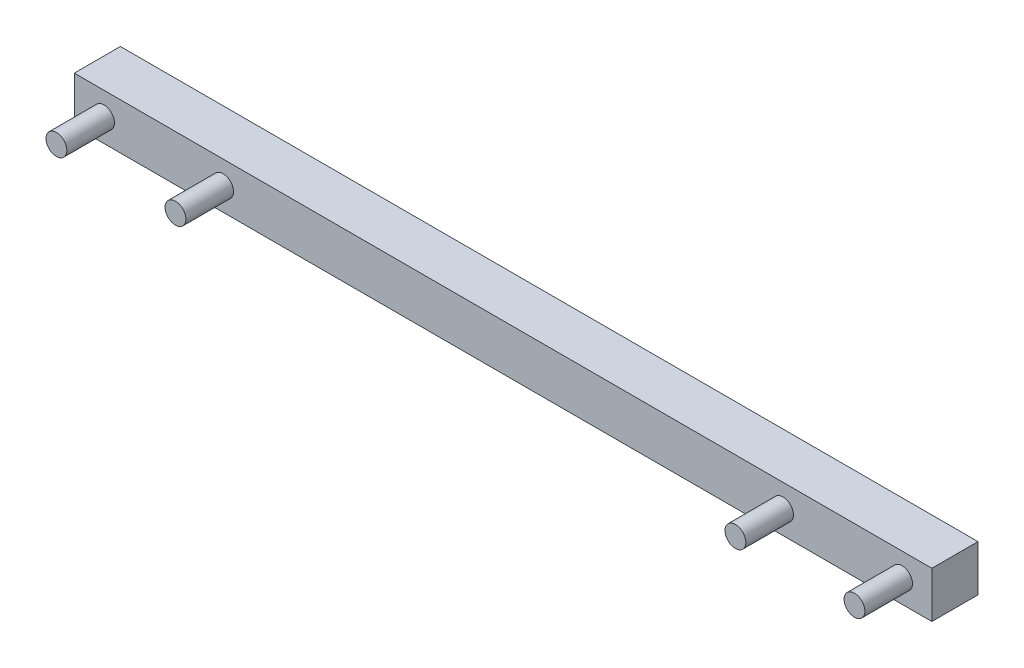
from build123d import *

# Parameters (mm, degrees)
SKETCH_2_R        = 3.5
EXTRUDE_1_DEPTH   = 16
EXTRUDE_1_2_DEPTH = 16
EXTRUDE_1_3_DEPTH = 16
EXTRUDE_1_4_DEPTH = 16
SKETCH_3_W        = 288.1
SKETCH_3_H        = 15.5
EXTRUDE_2_DEPTH   = 15.5


with BuildPart() as part:
    # 草图2 → 凸台-拉伸1 (new body)
    with BuildSketch(Plane.XY):
        with Locations((-164, 0)):
            Circle(SKETCH_2_R)
    extrude(amount=EXTRUDE_1_DEPTH)



with BuildPart() as body_2:
    # 草图2 → Extrude 1 2 (new body)
    with BuildSketch(Plane.XY):
        with Locations((24.1, 0)):
            Circle(SKETCH_2_R)
    extrude(amount=EXTRUDE_1_2_DEPTH)


with BuildPart() as body_3:
    # 草图2 → Extrude 1 3 (new body)
    with BuildSketch(Plane.XY):
        with Locations((-204, 0)):
            Circle(SKETCH_2_R)
    extrude(amount=EXTRUDE_1_3_DEPTH)


with BuildPart() as body_4:
    # 草图2 → Extrude 1 4 (new body)
    with BuildSketch(Plane.XY):
        with Locations((64.1, 0)):
            Circle(SKETCH_2_R)
    extrude(amount=EXTRUDE_1_4_DEPTH)


with BuildPart() as part_1:
    add(part.part)

    add(body_2.part)  # 凸台-拉伸2 merges body 2

    add(body_3.part)  # 凸台-拉伸2 merges body 3

    add(body_4.part)  # 凸台-拉伸2 merges body 4
    # 草图3 → 凸台-拉伸2 (add)
    with BuildSketch(Plane(origin=(0, 0, 0), x_dir=(-1, 0, 0), z_dir=(0, 0, -1))):
        with Locations((69.95, 0)):
            Rectangle(SKETCH_3_W, SKETCH_3_H)
    extrude(amount=EXTRUDE_2_DEPTH)


solid = part_1.part
